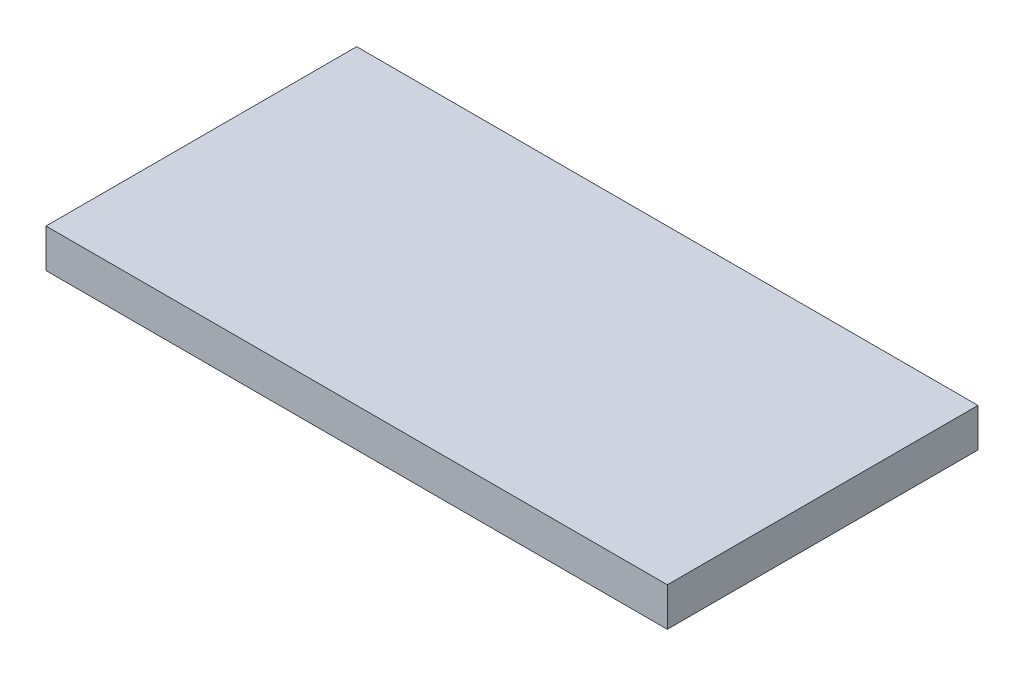
from build123d import *

# Parameters (mm, degrees)
CROQUIS1_W              = 101.6
CROQUIS1_H              = 50.8
SALIENTE_EXTRUIR1_DEPTH = 6.31


with BuildPart() as part:
    # Croquis1 → Saliente-Extruir1 (new body)
    with BuildSketch(Plane(origin=(0, 0, 0), x_dir=(1, 0, 0), z_dir=(0, 1, 0))):
        Rectangle(CROQUIS1_W, CROQUIS1_H)
    extrude(amount=SALIENTE_EXTRUIR1_DEPTH)


solid = part.part
